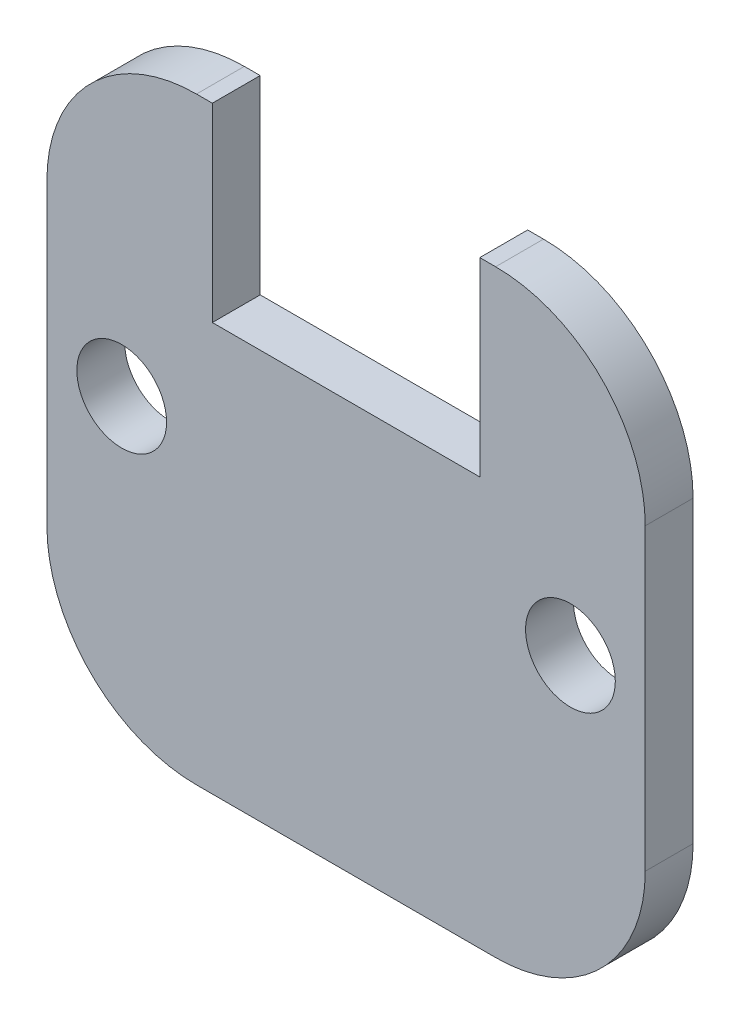
from build123d import *

# Parameters (mm, degrees)
SKETCH13_R          = 1.5
BOSS_EXTRUDE1_DEPTH = 1.6


with BuildPart() as part:
    # Sketch13 → Boss-Extrude1 (new body)
    with BuildSketch(Plane.XY):
        with BuildLine():
            Line((115.98540719, 133.738694526), (115.45540719, 133.738694526))
            ThreePointArc((115.45540719, 133.738694526), (111.919873284, 132.274228432), (110.45540719, 128.738694526))
            Line((110.45540719, 128.738694526), (110.45540719, 118.738694526))
            ThreePointArc((110.45540719, 118.738694526), (111.919873284, 115.20316062), (115.45540719, 113.738694526))
            Line((115.45540719, 113.738694526), (125.45540719, 113.738694526))
            ThreePointArc((125.45540719, 113.738694526), (128.990941096, 115.20316062), (130.45540719, 118.738694526))
            Line((130.45540719, 118.738694526), (130.45540719, 128.738694526))
            ThreePointArc((130.45540719, 128.738694526), (128.990941096, 132.274228432), (125.45540719, 133.738694526))
            Line((125.45540719, 133.738694526), (124.92540719, 133.738694526))
            Line((124.92540719, 133.738694526), (124.92540719, 127.388694526))
            Line((124.92540719, 127.388694526), (115.98540719, 127.388694526))
            Line((115.98540719, 127.388694526), (115.98540719, 133.738694526))
        make_face()
        with Locations((112.95540719, 123.738694526)):
            Circle(SKETCH13_R, mode=Mode.SUBTRACT)
        with Locations((127.95540719, 123.738694526)):
            Circle(SKETCH13_R, mode=Mode.SUBTRACT)
    extrude(amount=BOSS_EXTRUDE1_DEPTH)


solid = part.part
